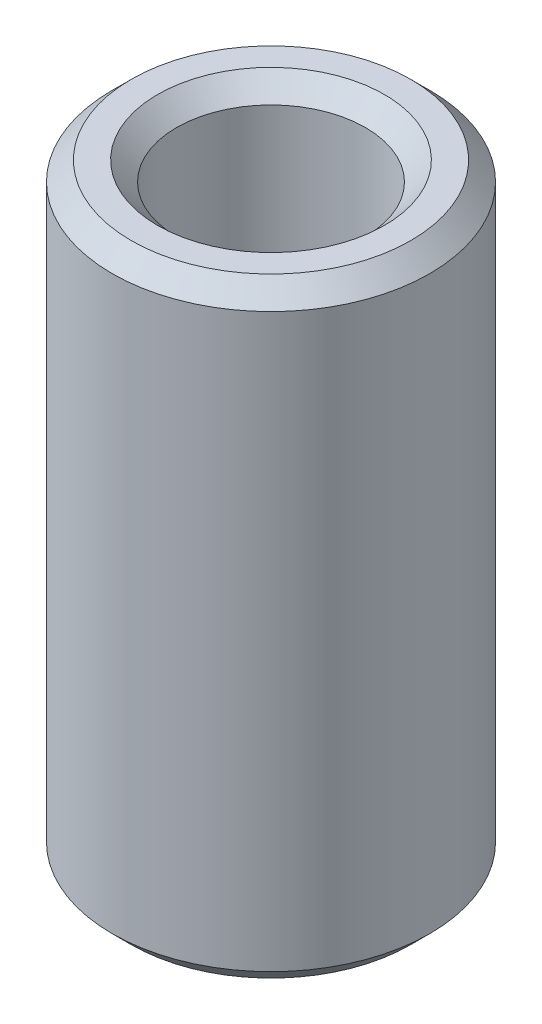
from build123d import *

# Parameters (mm, degrees)
CROQUIS1_R              = 6.25
CROQUIS1_R_2            = 3.715
SALIENTE_EXTRUIR1_DEPTH = 12
CHAFL_N1_SIZE           = 0.75


with BuildPart() as part:
    # Croquis1 → Saliente-Extruir1 (new, symmetric)
    with BuildSketch(Plane(origin=(0, 0, 0), x_dir=(1, 0, 0), z_dir=(0, 1, 0))):
        with Locations(Location((0, 0, 0), (0, 0, 270))):
            Circle(CROQUIS1_R)
        with Locations(Location((0, 0, 0), (0, 0, 270))):
            Circle(CROQUIS1_R_2, mode=Mode.SUBTRACT)
    extrude(amount=SALIENTE_EXTRUIR1_DEPTH, both=True)

    # Chaflán1
    chafl_n1_edges = [part.edges().sort_by_distance(p)[0] for p in [
        (0, -12, -6.25),
        (0, 12, -6.25),
        (0, -12, -3.715),
        (0, 12, -3.715),
    ]]
    chamfer(chafl_n1_edges, length=CHAFL_N1_SIZE)


solid = part.part
